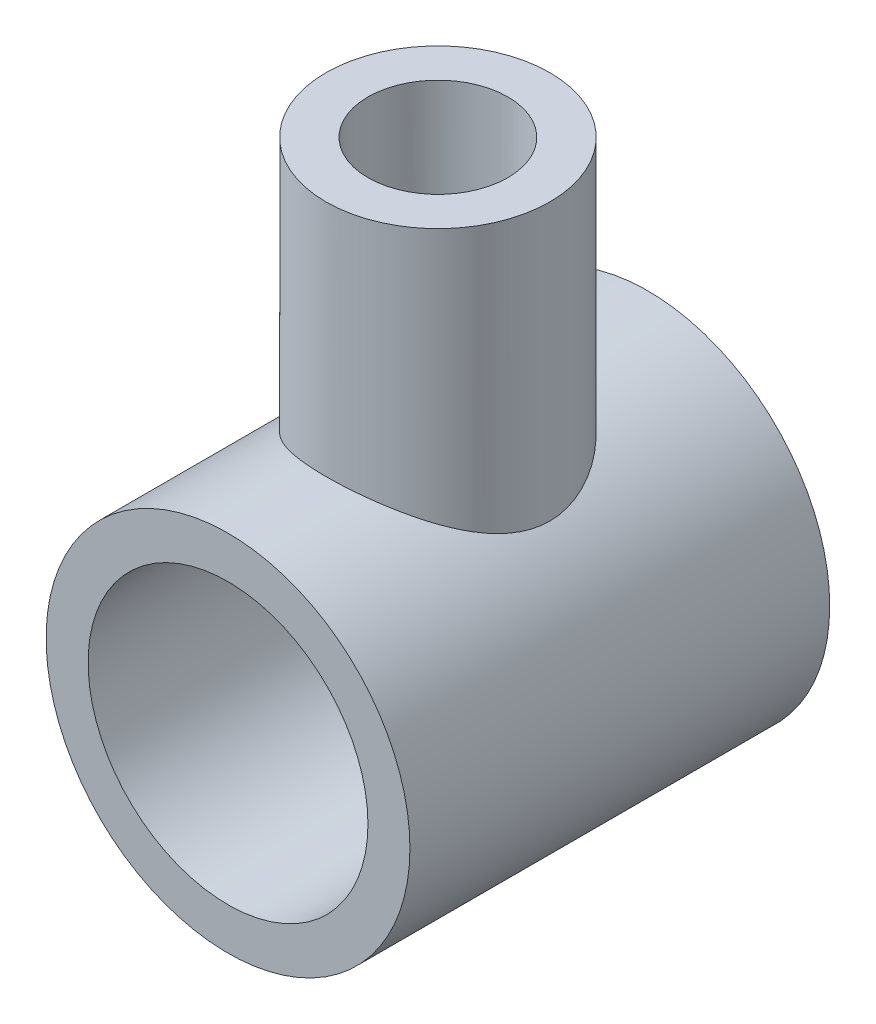
from build123d import *

# Parameters (mm, degrees)
SKETCH1_R           = 4
SKETCH1_R_2         = 2.5
BOSS_EXTRUDE1_DEPTH = 15
SKETCH2_R           = 6.5
BOSS_EXTRUDE3_DEPTH = 7.5
SKETCH3_R           = 5
CUT_EXTRUDE1_DEPTH  = 15


with BuildPart() as part:
    # Sketch1 → Boss-Extrude1 (new body)
    with BuildSketch(Plane(origin=(0, 0, 0), x_dir=(1, 0, 0), z_dir=(0, 1, 0))):
        with Locations(Location((0, 0, 0), (0, 0, 270))):
            Circle(SKETCH1_R)
        with Locations(Location((0, 0, 0), (0, 0, 270))):
            Circle(SKETCH1_R_2, mode=Mode.SUBTRACT)
    extrude(amount=BOSS_EXTRUDE1_DEPTH)

    # Sketch2 → Boss-Extrude3 (add, symmetric)
    with BuildSketch(Plane.XY):
        Circle(SKETCH2_R)
    extrude(amount=BOSS_EXTRUDE3_DEPTH, both=True)

    # Sketch3 → Cut-Extrude1 (cut)
    with BuildSketch(Plane.XY.offset(7.5)):
        Circle(SKETCH3_R)
    extrude(amount=-CUT_EXTRUDE1_DEPTH, mode=Mode.SUBTRACT)


solid = part.part
